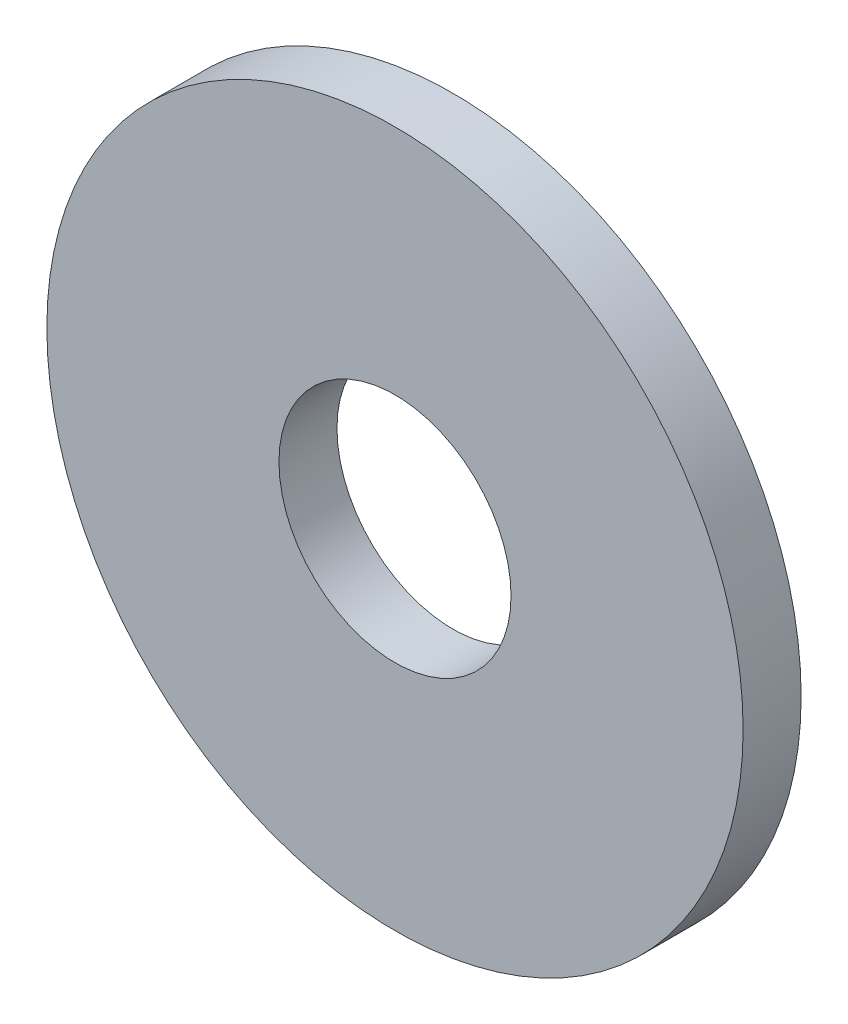
from build123d import *

# Parameters (mm, degrees)
SKETCH1_R          = 6
STEEL_WASHER_DEPTH = 1
SKETCH2_R          = 2
CUT_EXTRUDE1_DEPTH = 9.544003745


with BuildPart() as part:
    # Sketch1 → steel_washer (new body)
    with BuildSketch(Plane.XY):
        Circle(SKETCH1_R)
    extrude(amount=STEEL_WASHER_DEPTH)

    # Sketch2 → Cut-Extrude1 (cut, through all)
    with BuildSketch(Plane.XY.offset(1)):
        Circle(SKETCH2_R)
    extrude(amount=-CUT_EXTRUDE1_DEPTH, mode=Mode.SUBTRACT)


solid = part.part
